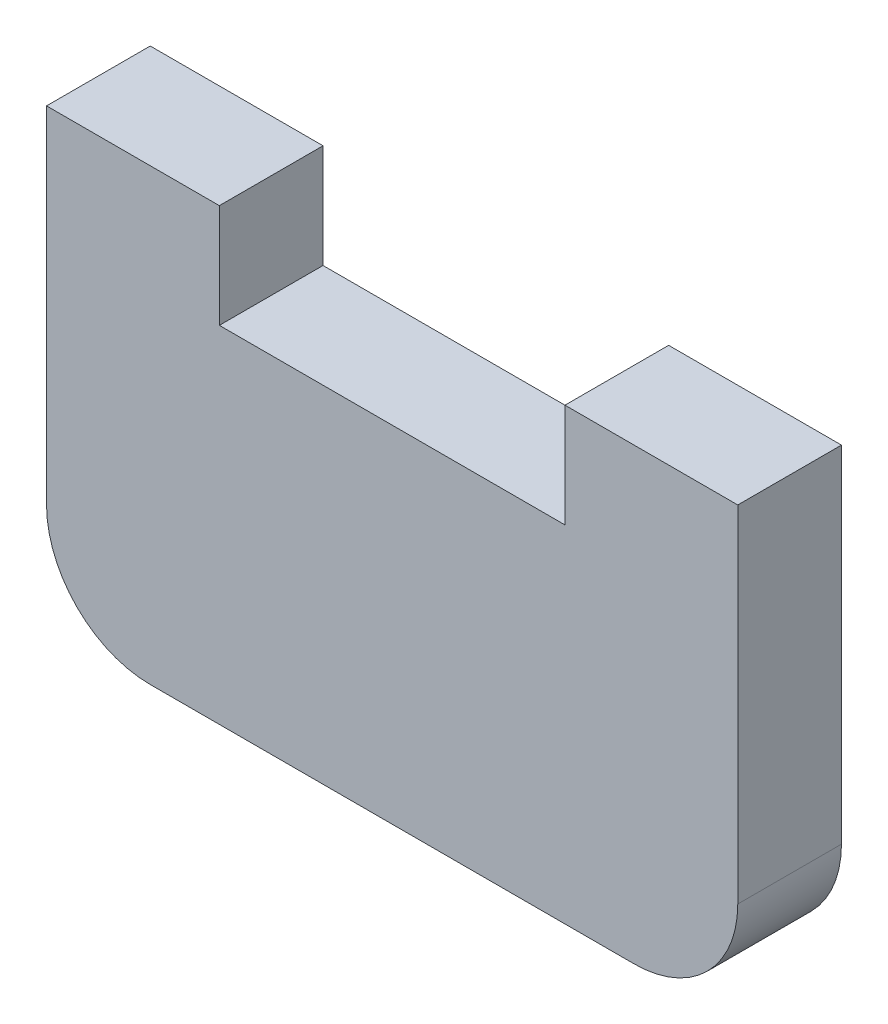
from build123d import *

# Parameters (mm, degrees)
SALIENTE_EXTRUIR1_DEPTH = 3


with BuildPart() as part:
    # Croquis1 → Saliente-Extruir1 (new body)
    with BuildSketch(Plane.XY):
        with BuildLine():
            Line((0, 22.001027223), (-5, 22.001027223))
            Line((-5, 22.001027223), (-5, 12.001027223))
            ThreePointArc((-5, 12.001027223), (-4.121320344, 9.87970688), (-2, 9.001027223))
            Line((-2, 9.001027223), (12, 9.001027223))
            ThreePointArc((12, 9.001027223), (14.121320344, 9.87970688), (15, 12.001027223))
            Line((15, 12.001027223), (15, 22.001027223))
            Line((15, 22.001027223), (10, 22.001027223))
            Line((10, 22.001027223), (10, 19.001027223))
            Line((10, 19.001027223), (0, 19.001027223))
            Line((0, 19.001027223), (0, 22.001027223))
        make_face()
    extrude(amount=SALIENTE_EXTRUIR1_DEPTH)


solid = part.part
